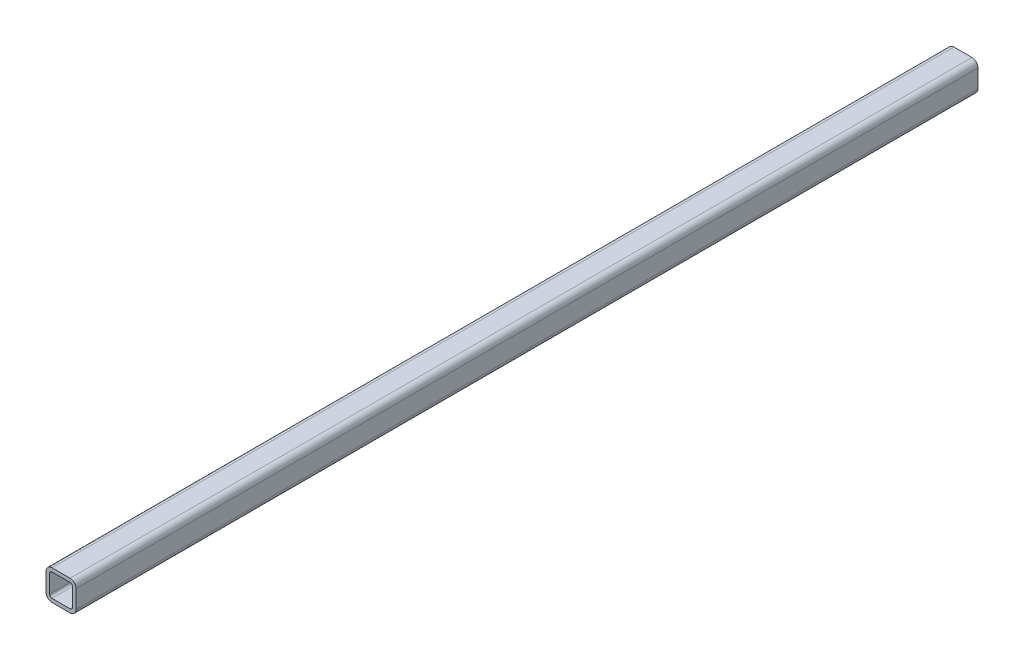
from build123d import *

# Parameters (mm, degrees)
BOSS_EXTRUDE1_DEPTH = 750


with BuildPart() as part:
    # Sketch1 → Boss-Extrude1 (new body)
    with BuildSketch(Plane.XY):
        with BuildLine():
            Line((-7.5, -12.5), (7.5, -12.5))
            ThreePointArc((7.5, -12.5), (11.035533906, -11.035533906), (12.5, -7.5))
            Line((12.5, -7.5), (12.5, 7.5))
            ThreePointArc((12.5, 7.5), (11.035533906, 11.035533906), (7.5, 12.5))
            Line((7.5, 12.5), (-7.5, 12.5))
            ThreePointArc((-7.5, 12.5), (-11.035533906, 11.035533906), (-12.5, 7.5))
            Line((-12.5, 7.5), (-12.5, -7.5))
            ThreePointArc((-12.5, -7.5), (-11.035533906, -11.035533906), (-7.5, -12.5))
        make_face()
        with BuildLine():
            Line((-9.5, 7.5), (-9.5, -7.5))
            ThreePointArc((-9.5, -7.5), (-8.914213562, -8.914213562), (-7.5, -9.5))
            Line((-7.5, -9.5), (7.5, -9.5))
            ThreePointArc((7.5, -9.5), (8.914213562, -8.914213562), (9.5, -7.5))
            Line((9.5, -7.5), (9.5, 7.5))
            ThreePointArc((9.5, 7.5), (8.914213562, 8.914213562), (7.5, 9.5))
            Line((7.5, 9.5), (-7.5, 9.5))
            ThreePointArc((-7.5, 9.5), (-8.914213562, 8.914213562), (-9.5, 7.5))
        make_face(mode=Mode.SUBTRACT)
    extrude(amount=BOSS_EXTRUDE1_DEPTH)


solid = part.part
